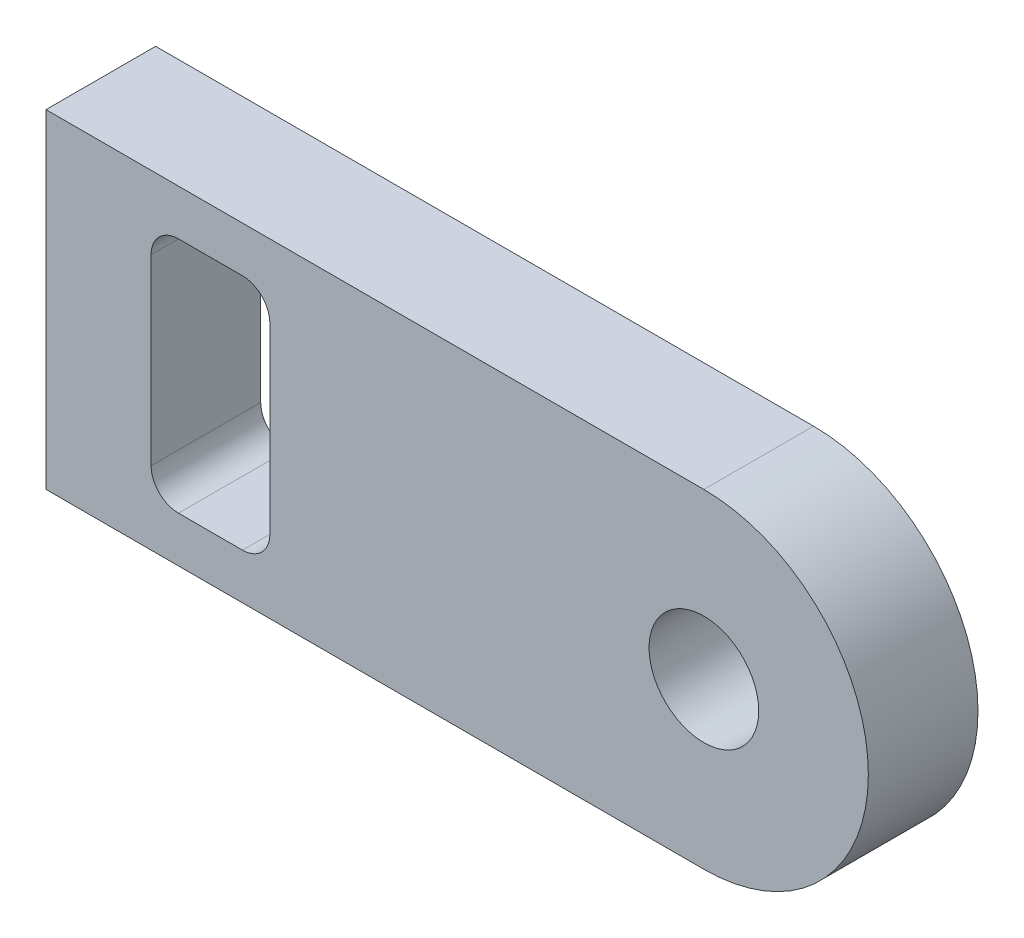
from build123d import *

# Parameters (mm, degrees)
MODEL_R                 = 1.5
SALIENTE_EXTRUIR1_DEPTH = 3


with BuildPart() as part:
    # Model → Saliente-Extruir1 (new body)
    with BuildSketch(Plane.XY):
        with BuildLine():
            Line((183.097853309, 273.646547335), (201.097853309, 273.646547335))
            ThreePointArc((201.097853309, 273.646547335), (205.597853309, 269.146547335), (201.097853309, 264.646547335))
            Line((201.097853309, 264.646547335), (183.097853309, 264.646547335))
            Line((183.097853309, 264.646547335), (183.097853309, 273.646547335))
        make_face()
        with Locations((201.097853309, 269.146547335)):
            Circle(MODEL_R, mode=Mode.SUBTRACT)
        with BuildLine():
            Line((186.722853309, 265.896547335), (188.472853309, 265.896547335))
            ThreePointArc((188.472853309, 265.896547335), (189.003183395, 266.116217249), (189.222853309, 266.646547335))
            Line((189.222853309, 266.646547335), (189.222853309, 271.646547335))
            ThreePointArc((189.222853309, 271.646547335), (189.003183395, 272.176877421), (188.472853309, 272.396547335))
            Line((188.472853309, 272.396547335), (186.722853309, 272.396547335))
            ThreePointArc((186.722853309, 272.396547335), (186.192523223, 272.176877421), (185.972853309, 271.646547335))
            Line((185.972853309, 271.646547335), (185.972853309, 266.646547335))
            ThreePointArc((185.972853309, 266.646547335), (186.192523223, 266.116217249), (186.722853309, 265.896547335))
        make_face(mode=Mode.SUBTRACT)
    extrude(amount=SALIENTE_EXTRUIR1_DEPTH)


solid = part.part
